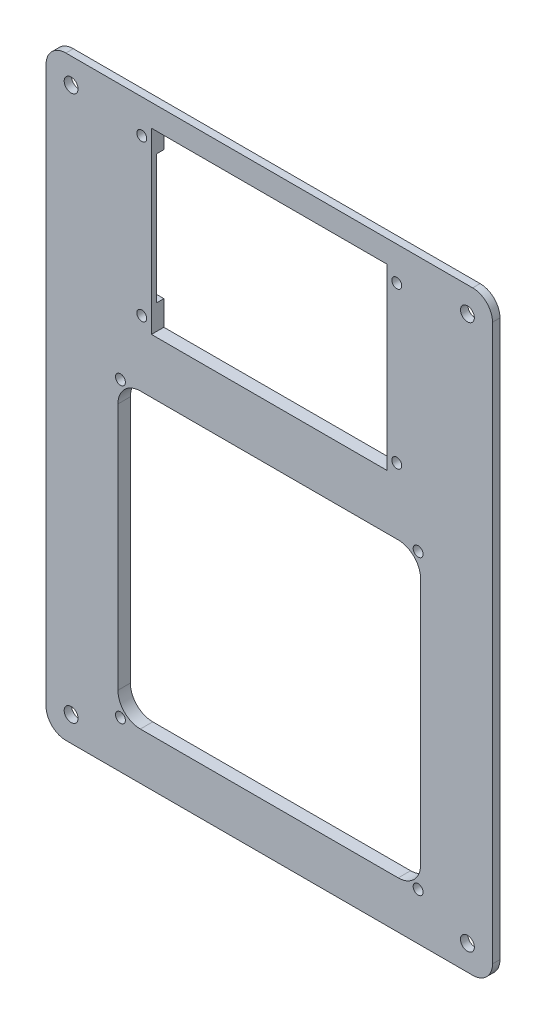
from build123d import *

# Parameters (mm, degrees)
SKETCH1_W               = 90
SKETCH1_H               = 120
BOSS_EXTRUDE1_DEPTH     = 2.5
SKETCH2_W               = 61
SKETCH2_H               = 59
SKETCH2_W_2             = 47.5
SKETCH2_H_2             = 36
CUT_EXTRUDE2_DEPTH      = 10
SKETCH4_W               = 90
SKETCH4_H               = 120
SKETCH4_W_2             = 86.4
SKETCH4_H_2             = 116.4
CUT_EXTRUDE4_DEPTH      = 1
FILLET2_R               = 4
FILLET3_R               = 4.512
SKETCH2_4_R             = 1
CUT_EXTRUDE6_DEPTH      = 1.5
SKETCH5_R               = 1
CUT_EXTRUDE9_DEPTH      = 1.5
SKETCH6_R               = 1
CUT_EXTRUDE10_DEPTH     = 5
SKETCH7_R               = 1
CUT_EXTRUDE11_DEPTH     = 5
SKETCH8_R               = 1
CUT_EXTRUDE12_DEPTH     = 5
SKETCH9_R               = 1
CUT_EXTRUDE13_DEPTH     = 5
SKETCH10_R              = 1
CUT_EXTRUDE14_DEPTH     = 5
SKETCH11_R              = 1
CUT_EXTRUDE15_DEPTH     = 5
SKETCH12_R              = 1
CUT_EXTRUDE16_DEPTH     = 5
SKETCH13_R              = 1
CUT_EXTRUDE17_DEPTH     = 5
SKE_VAT_R               = 8
VAT_DEPTH               = 1
MIRROR3_COPY_1_SKETCH_R = 8
MIRROR3_COPY_1_DEPTH    = 1
MIRROR3_COPY_2_SKETCH_R = 8
MIRROR3_COPY_2_DEPTH    = 1
SKETCH18_W              = 10
SKETCH18_H              = 26
CUT_EXTRUDE19_DEPTH     = 1.5
CUT_EXTRUDE20_DEPTH     = 10
MIRROR5_COPY_1_DEPTH    = 10


with BuildPart() as part:
    # Sketch1 → Boss-Extrude1 (new body)
    with BuildSketch(Plane.XY):
        Rectangle(SKETCH1_W, SKETCH1_H)
    extrude(amount=BOSS_EXTRUDE1_DEPTH)

    # Sketch2 → Cut-Extrude2 (cut)
    with BuildSketch(Plane.XY.offset(2.5)):
        with Locations((0, -21)):
            Rectangle(SKETCH2_W, SKETCH2_H)
        with Locations((0, 37.5)):
            Rectangle(SKETCH2_W_2, SKETCH2_H_2)
    extrude(amount=-CUT_EXTRUDE2_DEPTH, mode=Mode.SUBTRACT)

    # Sketch4 → Cut-Extrude4 (cut)
    with BuildSketch(Plane(origin=(0, 0, 0), x_dir=(-1, 0, 0), z_dir=(0, 0, -1))):
        Rectangle(SKETCH4_W, SKETCH4_H)
        Rectangle(SKETCH4_W_2, SKETCH4_H_2, mode=Mode.SUBTRACT)
    extrude(amount=-CUT_EXTRUDE4_DEPTH, mode=Mode.SUBTRACT)

    # Fillet2
    fillet2_edges = [part.edges().sort_by_distance(p)[0] for p in [
        (-45, 60, 1.75),
        (45, 60, 1.75),
        (45, -60, 1.75),
        (-45, -60, 1.75),
        (-43.2, -58.2, 0.5),
        (43.2, -58.2, 0.5),
        (-43.2, 58.2, 0.5),
        (43.2, 58.2, 0.5),
    ]]
    fillet(fillet2_edges, radius=FILLET2_R)

    # Fillet3
    fillet3_edges = [part.edges().sort_by_distance(p)[0] for p in [
        (-30.5, -50.5, 1.25),
        (30.5, -50.5, 1.25),
        (30.5, 8.5, 1.25),
        (-30.5, 8.5, 1.25),
    ]]
    fillet(fillet3_edges, radius=FILLET3_R)

    # Sketch2<4> → Cut-Extrude6 (cut)
    with BuildSketch(Plane.XY.offset(2.5)):
        with Locations((25.7, 53.2)):
            Circle(SKETCH2_4_R)
        with Locations((-25.7, 53.2)):
            Circle(SKETCH2_4_R)
        with Locations((-25.7, 21.8)):
            Circle(SKETCH2_4_R)
        with Locations((25.7, 21.8)):
            Circle(SKETCH2_4_R)
    extrude(amount=-CUT_EXTRUDE6_DEPTH, mode=Mode.SUBTRACT)

    # Sketch5 → Cut-Extrude9 (cut)
    with BuildSketch(Plane.XY.offset(2.5)):
        with Locations((-30, -50.5)):
            Circle(SKETCH5_R)
        with Locations((-30, 8.5)):
            Circle(SKETCH5_R)
        with Locations((30, 8.5)):
            Circle(SKETCH5_R)
        with Locations((30, -50.5)):
            Circle(SKETCH5_R)
    extrude(amount=-CUT_EXTRUDE9_DEPTH, mode=Mode.SUBTRACT)

    # Sketch6 → Cut-Extrude10 (cut)
    with BuildSketch(Plane.XY.offset(2.5)):
        with Locations((-30, 8.5)):
            Circle(SKETCH6_R)
    extrude(amount=-CUT_EXTRUDE10_DEPTH, mode=Mode.SUBTRACT)

    # Sketch7 → Cut-Extrude11 (cut)
    with BuildSketch(Plane.XY.offset(2.5)):
        with Locations((30, 8.5)):
            Circle(SKETCH7_R)
    extrude(amount=-CUT_EXTRUDE11_DEPTH, mode=Mode.SUBTRACT)

    # Sketch8 → Cut-Extrude12 (cut)
    with BuildSketch(Plane.XY.offset(2.5)):
        with Locations((-25.7, 21.8)):
            Circle(SKETCH8_R)
    extrude(amount=-CUT_EXTRUDE12_DEPTH, mode=Mode.SUBTRACT)

    # Sketch9 → Cut-Extrude13 (cut)
    with BuildSketch(Plane.XY.offset(2.5)):
        with Locations((25.7, 21.8)):
            Circle(SKETCH9_R)
    extrude(amount=-CUT_EXTRUDE13_DEPTH, mode=Mode.SUBTRACT)

    # Sketch10 → Cut-Extrude14 (cut)
    with BuildSketch(Plane.XY.offset(2.5)):
        with Locations((-30, -50.5)):
            Circle(SKETCH10_R)
    extrude(amount=-CUT_EXTRUDE14_DEPTH, mode=Mode.SUBTRACT)

    # Sketch11 → Cut-Extrude15 (cut)
    with BuildSketch(Plane.XY.offset(2.5)):
        with Locations((30, -50.5)):
            Circle(SKETCH11_R)
    extrude(amount=-CUT_EXTRUDE15_DEPTH, mode=Mode.SUBTRACT)

    # Sketch12 → Cut-Extrude16 (cut)
    with BuildSketch(Plane.XY.offset(2.5)):
        with Locations((25.7, 53.2)):
            Circle(SKETCH12_R)
    extrude(amount=-CUT_EXTRUDE16_DEPTH, mode=Mode.SUBTRACT)

    # Sketch13 → Cut-Extrude17 (cut)
    with BuildSketch(Plane.XY.offset(2.5)):
        with Locations((-25.7, 53.2)):
            Circle(SKETCH13_R)
    extrude(amount=-CUT_EXTRUDE17_DEPTH, mode=Mode.SUBTRACT)

    # ske_vat → vat (cut)
    with BuildSketch(Plane(origin=(0, 0, 0), x_dir=(1, 0, 0), z_dir=(0, 0, -1))):
        with Locations((42.028427125, -57.028427125)):
            Circle(SKE_VAT_R)
    vat = extrude(amount=-VAT_DEPTH, mode=Mode.SUBTRACT)

    # Mirror1: vat across plane
    add(vat.mirror(Plane(origin=(0, 0, 0), x_dir=(0, 0, 1), z_dir=(1, 0, 0))), mode=Mode.SUBTRACT)

    # Mirror2: vat across plane
    add(vat.mirror(Plane.ZX), mode=Mode.SUBTRACT)

    # Mirror3 copy 1 sketch → Mirror3 copy 1 (cut)
    with BuildSketch(Plane(origin=(0, 0, 0), x_dir=(-1, 0, 0), z_dir=(0, 0, -1))):
        with Locations((42.028427125, -57.028427125)):
            Circle(MIRROR3_COPY_1_SKETCH_R)
    extrude(amount=-MIRROR3_COPY_1_DEPTH, mode=Mode.SUBTRACT)

    # Mirror3 copy 2 sketch → Mirror3 copy 2 (cut)
    with BuildSketch(Plane(origin=(0, 0, 0), x_dir=(-1, 0, 0), z_dir=(0, 0, -1))):
        with Locations((42.028427125, 57.028427125)):
            Circle(MIRROR3_COPY_2_SKETCH_R)
    extrude(amount=-MIRROR3_COPY_2_DEPTH, mode=Mode.SUBTRACT)

    # Sketch18 → Cut-Extrude19 (cut)
    with BuildSketch(Plane(origin=(0, 0, 0), x_dir=(1, 0, 0), z_dir=(0, 0, -1))):
        with Locations((-28.75, -37.5)):
            Rectangle(SKETCH18_W, SKETCH18_H)
    extrude(amount=-CUT_EXTRUDE19_DEPTH, mode=Mode.SUBTRACT)

    # Sketch19 → Cut-Extrude20 (cut)
    with BuildSketch(Plane(origin=(0, 0, 1), x_dir=(1, 0, 0), z_dir=(0, 0, -1))):
        with BuildLine():
            ThreePointArc((40.929289322, -55.929289322), (41.232771174, -55.475096634), (41.339339828, -54.939339828))
            ThreePointArc((41.339339828, -54.939339828), (38.645908483, -54.403583023), (40.929289322, -55.929289322))
        make_face()
    cut_extrude20 = extrude(amount=-CUT_EXTRUDE20_DEPTH, mode=Mode.SUBTRACT)

    # Mirror4: Cut-Extrude20 across plane
    add(cut_extrude20.mirror(Plane(origin=(0, 0, 0), x_dir=(0, 0, 1), z_dir=(1, 0, 0))), mode=Mode.SUBTRACT)

    # Mirror5: Cut-Extrude20 across plane
    add(cut_extrude20.mirror(Plane.ZX), mode=Mode.SUBTRACT)

    # Mirror5 copy 1 sketch → Mirror5 copy 1 (cut)
    with BuildSketch(Plane(origin=(0, 0, 1), x_dir=(-1, 0, 0), z_dir=(0, 0, -1))):
        with BuildLine():
            ThreePointArc((40.929289322, -55.929289322), (41.232771174, -55.475096634), (41.339339828, -54.939339828))
            ThreePointArc((41.339339828, -54.939339828), (38.645908483, -54.403583023), (40.929289322, -55.929289322))
        make_face()
    extrude(amount=-MIRROR5_COPY_1_DEPTH, mode=Mode.SUBTRACT)


solid = part.part
